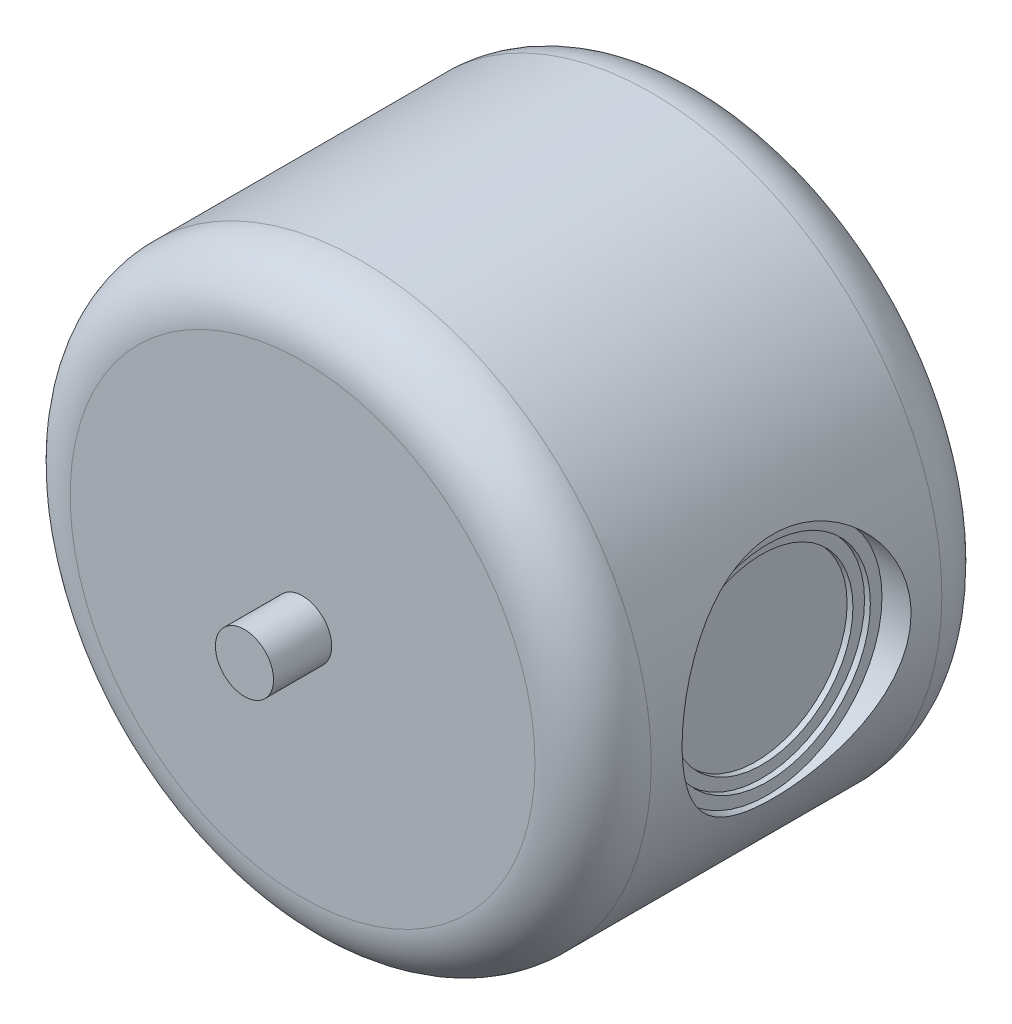
from build123d import *

# Parameters (mm, degrees)
SKETCH1_R           = 50
BOSS_EXTRUDE1_DEPTH = 35
SKETCH2_R           = 5
BOSS_EXTRUDE2_DEPTH = 45
FILLET1_R           = 10
SKETCH3_R           = 19.698674941
CUT_EXTRUDE1_DEPTH  = 5
SKETCH4_R           = 17.698674941
CUT_EXTRUDE2_DEPTH  = 1
SKETCH5_R           = 15.698674941
CUT_EXTRUDE3_DEPTH  = 1


with BuildPart() as part:
    # Sketch1 → Boss-Extrude1 (new, symmetric)
    with BuildSketch(Plane.XY):
        Circle(SKETCH1_R)
    extrude(amount=BOSS_EXTRUDE1_DEPTH, both=True)

    # Sketch2 → Boss-Extrude2 (add, symmetric)
    with BuildSketch(Plane.XY):
        with Locations(Location((0, 0, 0), (0, 0, 180))):
            Circle(SKETCH2_R)
    extrude(amount=BOSS_EXTRUDE2_DEPTH, both=True)

    # Fillet1
    fillet1_edges = [part.edges().sort_by_distance(p)[0] for p in [
        (-50, 0, -35),
        (-50, 0, 35),
    ]]
    fillet(fillet1_edges, radius=FILLET1_R)

    # Sketch3 → Cut-Extrude1 (cut)
    with BuildSketch(Plane(origin=(50, 0, 0), x_dir=(0, 0, -1), z_dir=(1, 0, 0))):
        Circle(SKETCH3_R)
    extrude(amount=-CUT_EXTRUDE1_DEPTH, mode=Mode.SUBTRACT)

    # Sketch4 → Cut-Extrude2 (cut)
    with BuildSketch(Plane(origin=(45, 0, 0), x_dir=(0, 0, -1), z_dir=(1, 0, 0))):
        Circle(SKETCH4_R)
    extrude(amount=-CUT_EXTRUDE2_DEPTH, mode=Mode.SUBTRACT)

    # Sketch5 → Cut-Extrude3 (cut)
    with BuildSketch(Plane(origin=(44, 0, 0), x_dir=(0, 0, -1), z_dir=(1, 0, 0))):
        Circle(SKETCH5_R)
    extrude(amount=-CUT_EXTRUDE3_DEPTH, mode=Mode.SUBTRACT)


solid = part.part
